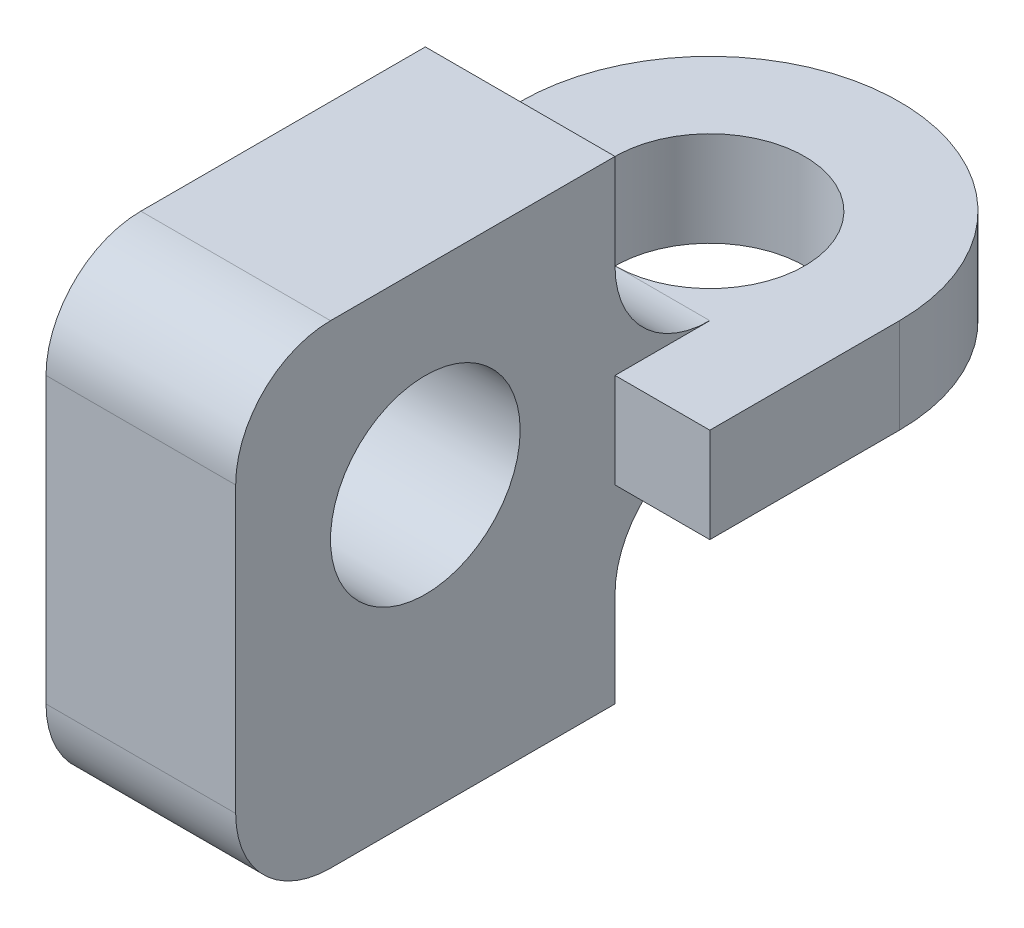
from build123d import *

# Parameters (mm, degrees)
SKETCH1_R           = 254
BOSS_EXTRUDE2_DEPTH = 254
SKETCH3_R           = 254
BOSS_EXTRUDE3_DEPTH = 254


with BuildPart() as part:
    # Sketch1 → Boss-Extrude2 (new, symmetric)
    with BuildSketch(Plane(origin=(0, 0, 0), x_dir=(0, 0, -1), z_dir=(1, 0, 0))):
        with BuildLine():
            ThreePointArc((-508, 863.6), (-687.605122421, 789.205122421), (-762, 609.6))
            Line((-762, 609.6), (-762, -152.4))
            ThreePointArc((-762, -152.4), (-687.605122421, -332.005122421), (-508, -406.4))
            Line((-508, -406.4), (254, -406.4))
            Line((254, -406.4), (254, -152.4))
            ThreePointArc((254, -152.4), (328.394877579, 27.205122421), (508, 101.6))
            Line((508, 101.6), (254, 101.6))
            Line((254, 101.6), (254, 355.6))
            Line((254, 355.6), (508, 355.6))
            ThreePointArc((508, 355.6), (328.394877579, 429.994877579), (254, 609.6))
            Line((254, 609.6), (254, 863.6))
            Line((254, 863.6), (-508, 863.6))
        make_face()
        with Locations((-254, 355.6)):
            Circle(SKETCH1_R, mode=Mode.SUBTRACT)
    extrude(amount=BOSS_EXTRUDE2_DEPTH, both=True)

    # Sketch3 → Boss-Extrude3 (add)
    with BuildSketch(Plane(origin=(0, 101.6, 0), x_dir=(1, 0, 0), z_dir=(0, 1, 0))):
        with BuildLine():
            Line((-508, 254), (508, 254))
            Line((508, 254), (508, 762))
            ThreePointArc((508, 762), (0, 1270), (-508, 762))
            Line((-508, 762), (-508, 254))
        make_face()
        with Locations((0, 762)):
            Circle(SKETCH3_R, mode=Mode.SUBTRACT)
    extrude(amount=BOSS_EXTRUDE3_DEPTH)


solid = part.part
